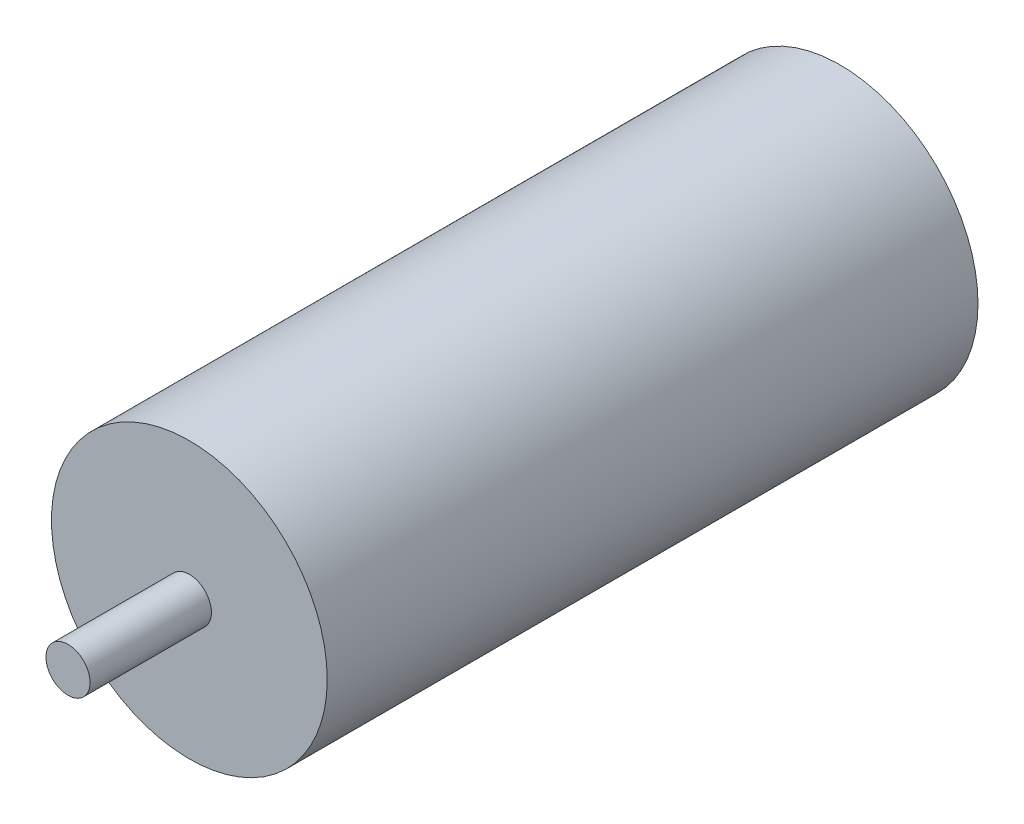
from build123d import *

# Parameters (mm, degrees)
SKETCH1_R           = 2
BOSS_EXTRUDE1_DEPTH = 11
SKETCH2_R           = 12.5
BOSS_EXTRUDE2_DEPTH = 59


with BuildPart() as part:
    # Sketch1 → Boss-Extrude1 (new body)
    with BuildSketch(Plane.XY):
        Circle(SKETCH1_R)
    extrude(amount=BOSS_EXTRUDE1_DEPTH)

    # Sketch2 → Boss-Extrude2 (add)
    with BuildSketch(Plane(origin=(0, 0, 0), x_dir=(-1, 0, 0), z_dir=(0, 0, -1))):
        with Locations(Location((0, 0, 0), (0, 0, 180))):
            Circle(SKETCH2_R)
    extrude(amount=BOSS_EXTRUDE2_DEPTH)


solid = part.part
